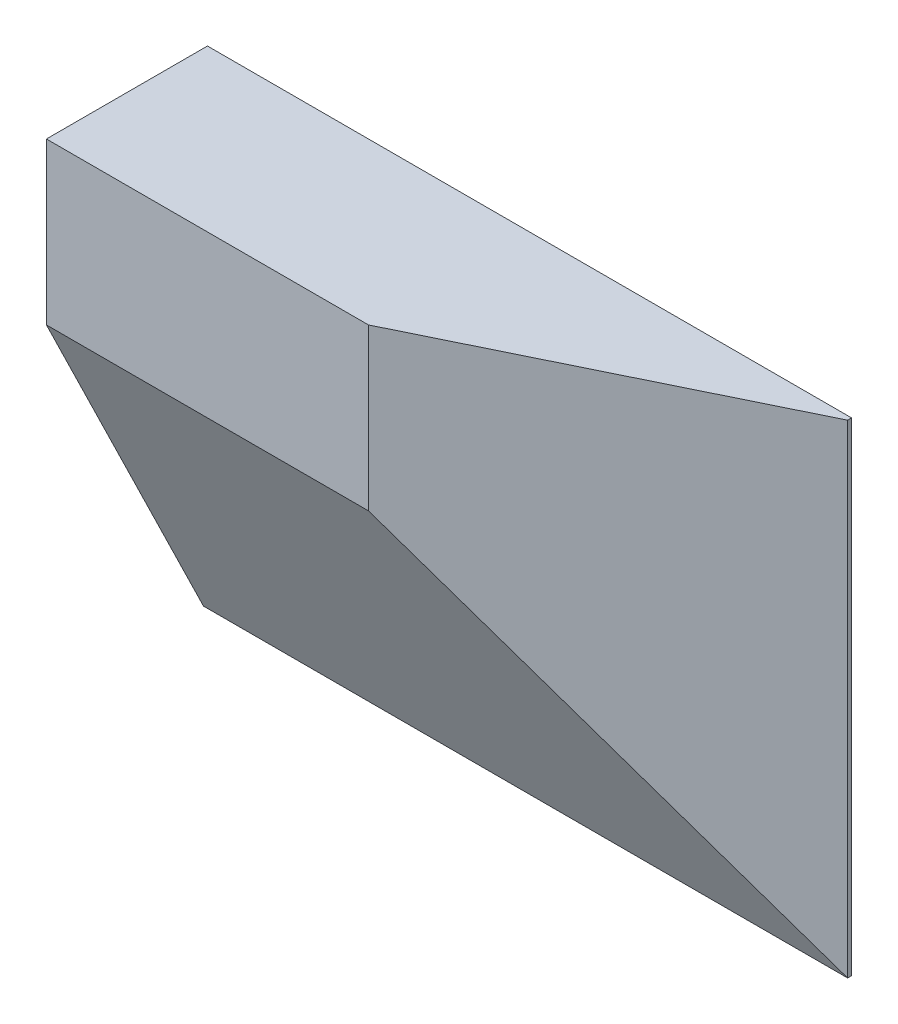
from build123d import *

# Parameters (mm, degrees)
SKETCH1_W           = 10
SKETCH1_H           = 30
BOSS_EXTRUDE1_DEPTH = 40
CHAMFER1_SIZE       = 20
CHAMFER1_SIZE2      = 9.754651771
CHAMFER2_SIZE       = 20
CHAMFER2_SIZE2      = 9.754651771


with BuildPart() as part:
    # Sketch1 → Boss-Extrude1 (new body)
    with BuildSketch(Plane(origin=(0, 0, 0), x_dir=(0, 0, -1), z_dir=(1, 0, 0))):
        Rectangle(SKETCH1_W, SKETCH1_H)
    extrude(amount=BOSS_EXTRUDE1_DEPTH)

    # Chamfer1
    chamfer1_edges = [part.edges().sort_by_distance(p)[0] for p in [
        (40, 0, 5),
    ]]
    chamfer1_side = [part.faces().sort_by_distance(p)[0] for p in [
        (20, 0, 5),
    ]]
    chamfer(chamfer1_edges, length=CHAMFER1_SIZE, length2=CHAMFER1_SIZE2, reference=chamfer1_side[0])

    # Chamfer2
    chamfer2_edges = [part.edges().sort_by_distance(p)[0] for p in [
        (10, -15, 5),
    ]]
    chamfer2_side = [part.faces().sort_by_distance(p)[0] for p in [
        (10, 0, 5),
    ]]
    chamfer(chamfer2_edges, length=CHAMFER2_SIZE, length2=CHAMFER2_SIZE2, reference=chamfer2_side[0])


solid = part.part
